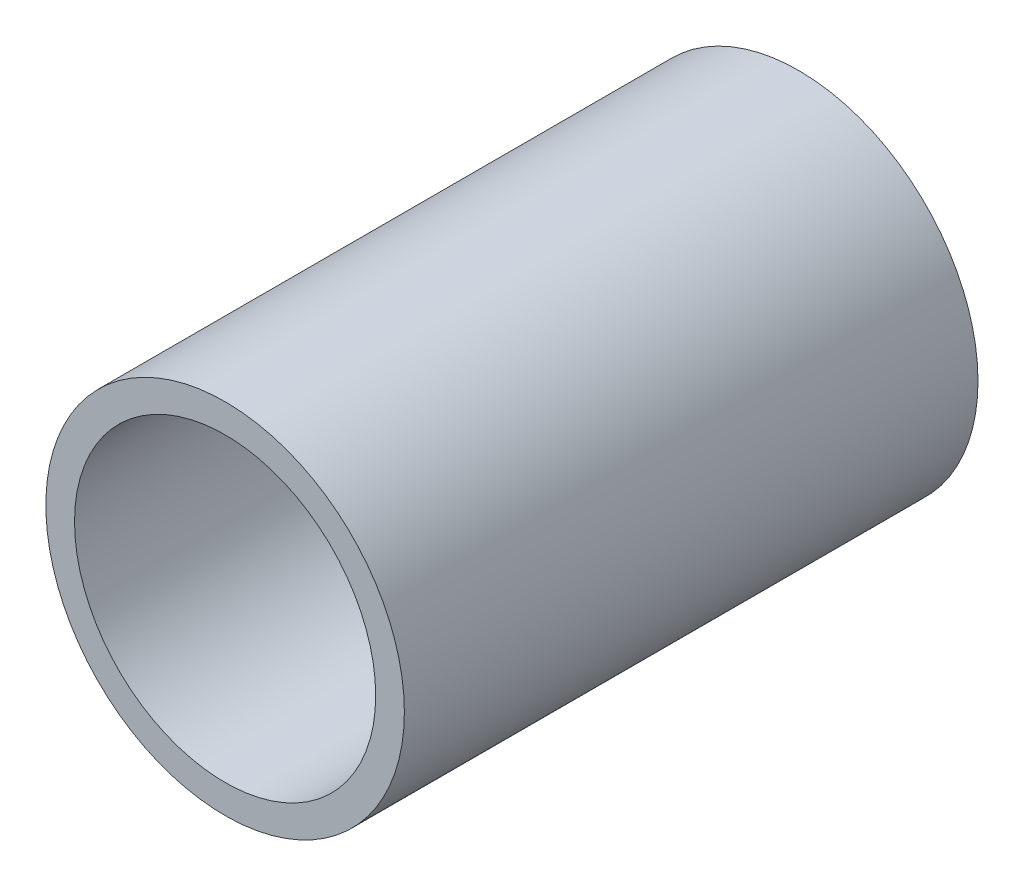
from build123d import *

# Parameters (mm, degrees)
SKETCH_1_R      = 3.75
SKETCH_1_R_2    = 3.15
EXTRUDE_1_DEPTH = 12


with BuildPart() as part:
    # ｽｹｯﾁ1 → ﾎﾞｽ - 押し出し1 (new body)
    with BuildSketch(Plane.XY):
        Circle(SKETCH_1_R)
        Circle(SKETCH_1_R_2, mode=Mode.SUBTRACT)
    extrude(amount=EXTRUDE_1_DEPTH)


solid = part.part
